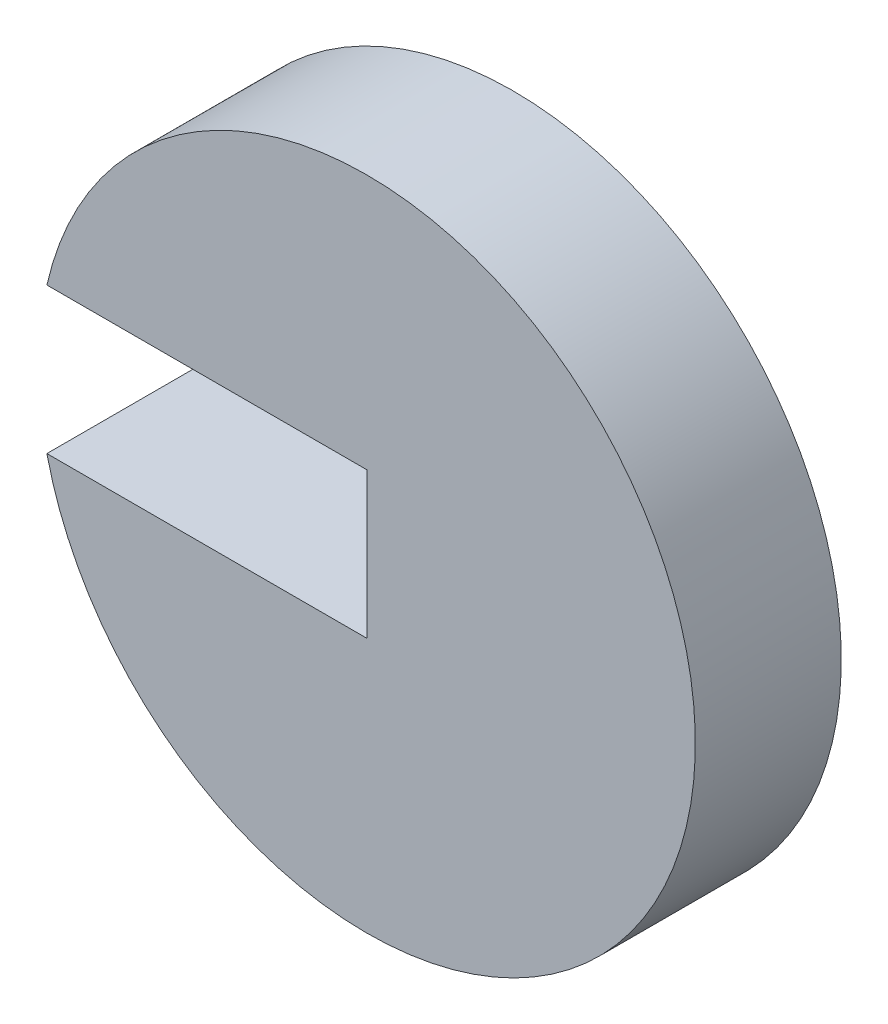
from build123d import *

# Parameters (mm, degrees)
SALIENTE_EXTRUIR1_DEPTH = 3


with BuildPart() as part:
    # Croquis1 → Saliente-Extruir1 (new body)
    with BuildSketch(Plane.XY):
        with BuildLine():
            Line((0, -1.5), (0, 1.5))
            Line((0, 1.5), (-6.581223291, 1.5))
            ThreePointArc((-6.581223291, 1.5), (6.75, 0), (-6.581223291, -1.5))
            Line((-6.581223291, -1.5), (0, -1.5))
        make_face()
    extrude(amount=SALIENTE_EXTRUIR1_DEPTH)


solid = part.part
